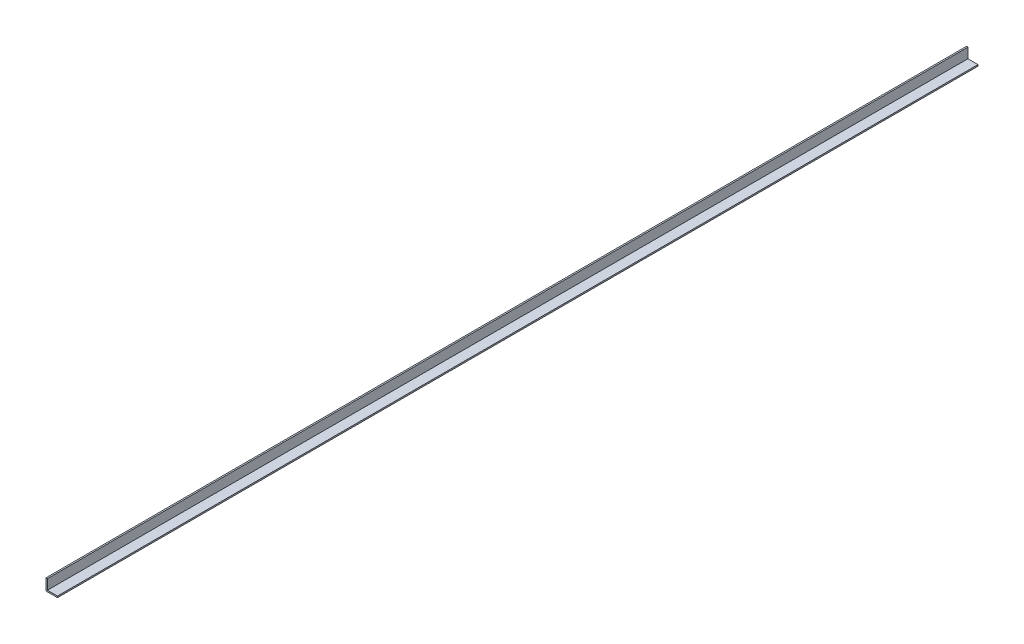
from build123d import *

# Parameters (mm, degrees)
SALIENTE_EXTRUIR1_DEPTH = 6100


with BuildPart() as part:
    # Croquis1 → Saliente-Extruir1 (new body)
    with BuildSketch(Plane.XY):
        Polygon((0, 76.2), (0, 0), (76.2, 0), (76.2, 9.53), (9.53, 9.53), (9.53, 76.2), align=None)
    extrude(amount=-SALIENTE_EXTRUIR1_DEPTH)


solid = part.part
